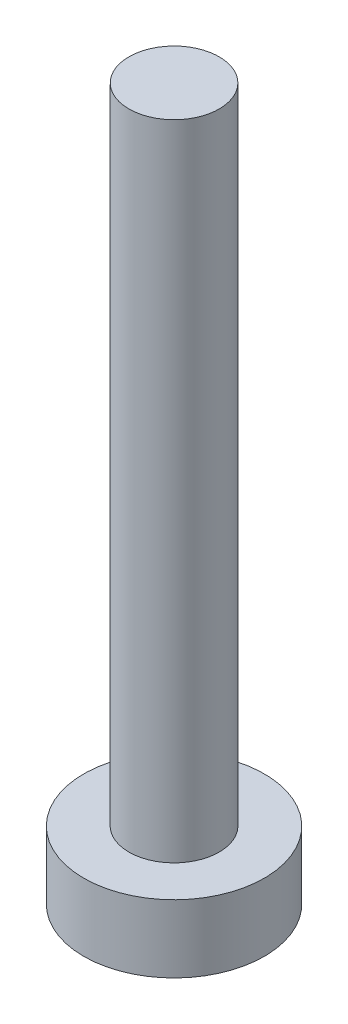
from build123d import *

# Parameters (mm, degrees)
ESQUISSE1_R        = 4
ESQUISSE1_R_2      = 2
BOSS_EXTRU_1_DEPTH = 3
ESQUISSE1_4_R      = 2
BOSS_EXTRU_3_DEPTH = 31.5


with BuildPart() as part:
    # Esquisse1 → Boss.-Extru.1 (new body)
    with BuildSketch(Plane(origin=(0, 0, 0), x_dir=(1, 0, 0), z_dir=(0, 1, 0))):
        with Locations(Location((0, 0, 0), (0, 0, 270))):
            Circle(ESQUISSE1_R)
        with Locations(Location((0, 0, 0), (0, 0, 270))):
            Circle(ESQUISSE1_R_2, mode=Mode.SUBTRACT)
    extrude(amount=BOSS_EXTRU_1_DEPTH)

    # Esquisse1<4> → Boss.-Extru.3 (add)
    with BuildSketch(Plane(origin=(0, 0, 0), x_dir=(1, 0, 0), z_dir=(0, 1, 0))):
        with Locations(Location((0, 0, 0), (0, 0, 270))):
            Circle(ESQUISSE1_4_R)
    extrude(amount=BOSS_EXTRU_3_DEPTH)


solid = part.part
